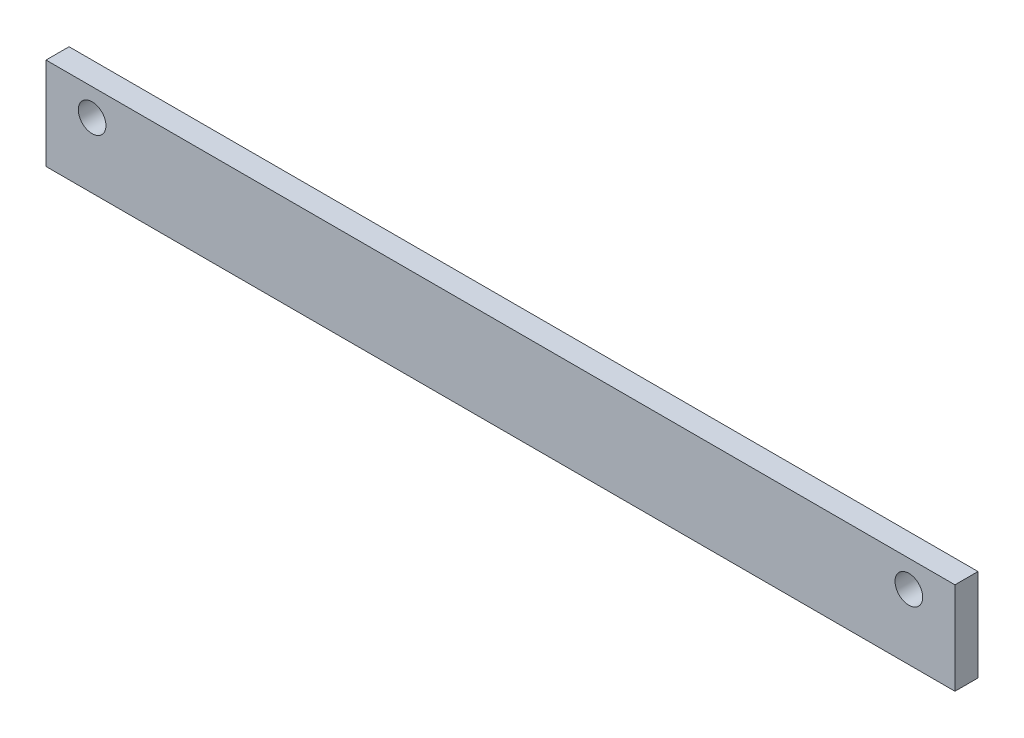
from build123d import *

# Parameters (mm, degrees)
SCHIZZO1_W                   = 394.303075113
SCHIZZO1_H                   = 40
SCHIZZO1_R                   = 6
ESTRUSIONE_ESTRUSIONE1_DEPTH = 5


with BuildPart() as part:
    # Schizzo1 → Estrusione-Estrusione1 (new, symmetric)
    with BuildSketch(Plane.XY):
        with Locations((177.151537557, 119.723097721)):
            Rectangle(SCHIZZO1_W, SCHIZZO1_H)
        with Locations((0, 128.056431054)):
            Circle(SCHIZZO1_R, mode=Mode.SUBTRACT)
        with Locations(Location((354.303075113, 128.056431054, 0), (0, 0, 180))):
            Circle(SCHIZZO1_R, mode=Mode.SUBTRACT)
    extrude(amount=ESTRUSIONE_ESTRUSIONE1_DEPTH, both=True)


solid = part.part
